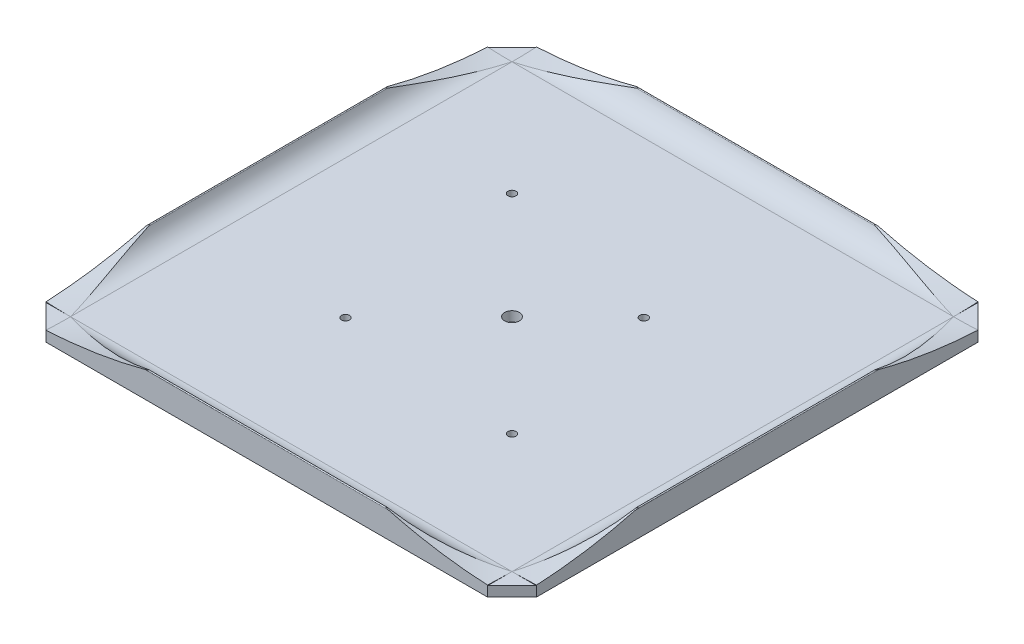
from build123d import *

# Parameters (mm, degrees)
SKETCH_1_W               = 200
SKETCH_1_H               = 200
SKETCH_1_R               = 3
SKETCH_1_R_2             = 1.65
EXTRUDE_1_DEPTH          = 4
EXTRUDE_3_DEPTH          = 90
EXTRUDE_4_DEPTH          = 90
CUT_EXTRUDE_1_DEPTH      = 10
SKETCH_9_R               = 100
CUT_EXTRUDE_2_DEPTH      = 70
PATTERN_CIRCULAR_1_COUNT = 4


with BuildPart() as part:
    # 草图1 → 凸台-拉伸1 (new body)
    with BuildSketch(Plane(origin=(0, 0, 0), x_dir=(1, 0, 0), z_dir=(0, 1, 0))):
        Rectangle(SKETCH_1_W, SKETCH_1_H)
        with Locations(Location((0, 0, 0), (0, 0, 270))):
            Circle(SKETCH_1_R, mode=Mode.SUBTRACT)
        with Locations(Location((27.223611076, 26.516504294, 0), (0, 0, 270))):
            Circle(SKETCH_1_R_2, mode=Mode.SUBTRACT)
        with Locations(Location((-43.487067043, 43.487067043, 0), (0, 0, 270))):
            Circle(SKETCH_1_R_2, mode=Mode.SUBTRACT)
        with Locations(Location((-33.587572106, -34.294678888, 0), (0, 0, 270))):
            Circle(SKETCH_1_R_2, mode=Mode.SUBTRACT)
        with Locations(Location((41.365746699, -41.365746699, 0), (0, 0, 270))):
            Circle(SKETCH_1_R_2, mode=Mode.SUBTRACT)
    extrude(amount=EXTRUDE_1_DEPTH)

    # 草图3 → 凸台-拉伸3 (add, symmetric)
    with BuildSketch(Plane(origin=(0, 0, 0), x_dir=(0, 0, -1), z_dir=(1, 0, 0))):
        with BuildLine():
            Line((-100, 4), (-90, 4))
            ThreePointArc((-90, 4), (-95.760553163, 5.825892877), (-99.417475728, 10.636794548))
            ThreePointArc((-99.417475728, 10.636794548), (-99.751199211, 10.831497168), (-100, 10.535898385))
            Line((-100, 10.535898385), (-100, 4))
        make_face()
        with BuildLine():
            Line((100, 4), (100, 10.535898385))
            ThreePointArc((100, 10.535898385), (99.751199211, 10.831497168), (99.417475728, 10.636794548))
            ThreePointArc((99.417475728, 10.636794548), (95.760553163, 5.825892877), (90, 4))
            Line((90, 4), (100, 4))
        make_face()
    extrude(amount=EXTRUDE_3_DEPTH, both=True)

    # 草图5 → 凸台-拉伸4 (add, symmetric)
    with BuildSketch(Plane.XY):
        with BuildLine():
            Line((-100, 4), (-90, 4))
            ThreePointArc((-90, 4), (-95.760553163, 5.825892877), (-99.417475728, 10.636794548))
            ThreePointArc((-99.417475728, 10.636794548), (-99.751199211, 10.831497168), (-100, 10.535898385))
            Line((-100, 10.535898385), (-100, 4))
        make_face()
        with BuildLine():
            Line((100, 4), (100, 10.535898385))
            ThreePointArc((100, 10.535898385), (99.751199211, 10.831497168), (99.417475728, 10.636794548))
            ThreePointArc((99.417475728, 10.636794548), (95.760553163, 5.825892877), (90, 4))
            Line((90, 4), (100, 4))
        make_face()
    extrude(amount=EXTRUDE_4_DEPTH, both=True)

    # 草图8 → 切除-拉伸1 (cut)
    with BuildSketch(Plane(origin=(0, 0, 0), x_dir=(1, 0, 0), z_dir=(0, 1, 0))):
        Polygon((-100, 100), (-100, 90), (-90, 100), align=None)
        Polygon((100, 90), (100, 100), (90, 100), align=None)
        Polygon((90, -100), (100, -100), (100, -90), align=None)
        Polygon((-100, -90), (-100, -100), (-90, -100), align=None)
    extrude(amount=CUT_EXTRUDE_1_DEPTH, mode=Mode.SUBTRACT)

    # 草图9 → 切除-拉伸2 (cut)
    with BuildSketch(Plane(origin=(95, 0, -95), x_dir=(-0.7071067811865466, 0, -0.7071067811865485), z_dir=(0.7071067811865485, 0, -0.7071067811865466))):
        with Locations((0, 104)):
            Circle(SKETCH_9_R)
    cut_extrude_2 = extrude(amount=-CUT_EXTRUDE_2_DEPTH, mode=Mode.SUBTRACT)

    # 阵列(圆周)1: 切除-拉伸2 ×4 about axis
    pattern_circular_1_axis = Axis((0, 4, 0), (0, -1, 0))
    for i in range(1, PATTERN_CIRCULAR_1_COUNT):
        add(cut_extrude_2.rotate(pattern_circular_1_axis, i * 360 / PATTERN_CIRCULAR_1_COUNT), mode=Mode.SUBTRACT)


solid = part.part
